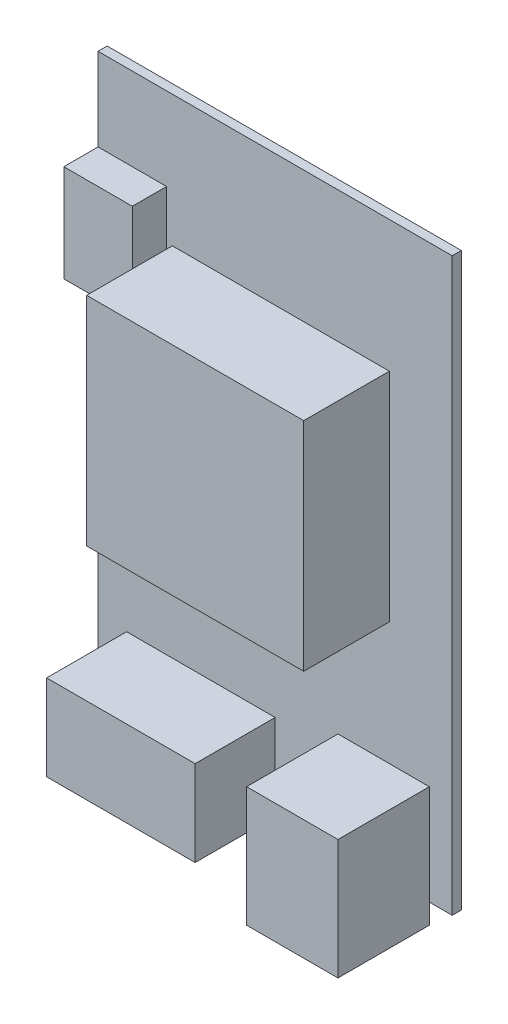
from build123d import *

# Parameters (mm, degrees)
SKETCH_1_W           = 62
SKETCH_1_H           = 100
F_5_PCB_100X62_DEPTH = 1.6
EXTRUDE_START        = 1.6
SKETCH_2_W           = 16
SKETCH_2_H           = 21
EXTRUDE_312_DEPTH    = 16
USB_START            = 1.6
SKETCH_3_W           = 26
SKETCH_3_H           = 15
USB_DEPTH            = 14
SKETCH_4_W           = 12
SKETCH_4_H           = 17
EXTRUDE_463_DEPTH    = 6
SKETCH_5_W           = 38
SKETCH_5_H           = 38
EXTRUDE_553_DEPTH    = 15


with BuildPart() as part:
    # 草图1 → 香橙派5_PCB官方外形100x62 (new body)
    with BuildSketch(Plane.XY):
        Rectangle(SKETCH_1_W, SKETCH_1_H)
    extrude(amount=F_5_PCB_100X62_DEPTH)

    # 草图2 → Extrude 312 (add)
    with BuildSketch(Plane.XY.offset(EXTRUDE_START)):
        with Locations((19, -43)):
            Rectangle(SKETCH_2_W, SKETCH_2_H)
    extrude(amount=EXTRUDE_312_DEPTH)

    # 草图3 → USB插拔包络_需按实物替换 (add)
    with BuildSketch(Plane.XY.offset(USB_START)):
        with Locations((-13, -43)):
            Rectangle(SKETCH_3_W, SKETCH_3_H)
    extrude(amount=USB_DEPTH)

    # 草图4 → Extrude 463 (add)
    with BuildSketch(Plane.XY.offset(EXTRUDE_START)):
        with Locations((-25, 27)):
            Rectangle(SKETCH_4_W, SKETCH_4_H)
    extrude(amount=EXTRUDE_463_DEPTH)

    # 草图5 → Extrude 553 (add)
    with BuildSketch(Plane.XY.offset(EXTRUDE_START)):
        with Locations((1, 8)):
            Rectangle(SKETCH_5_W, SKETCH_5_H)
    extrude(amount=EXTRUDE_553_DEPTH)


solid = part.part
